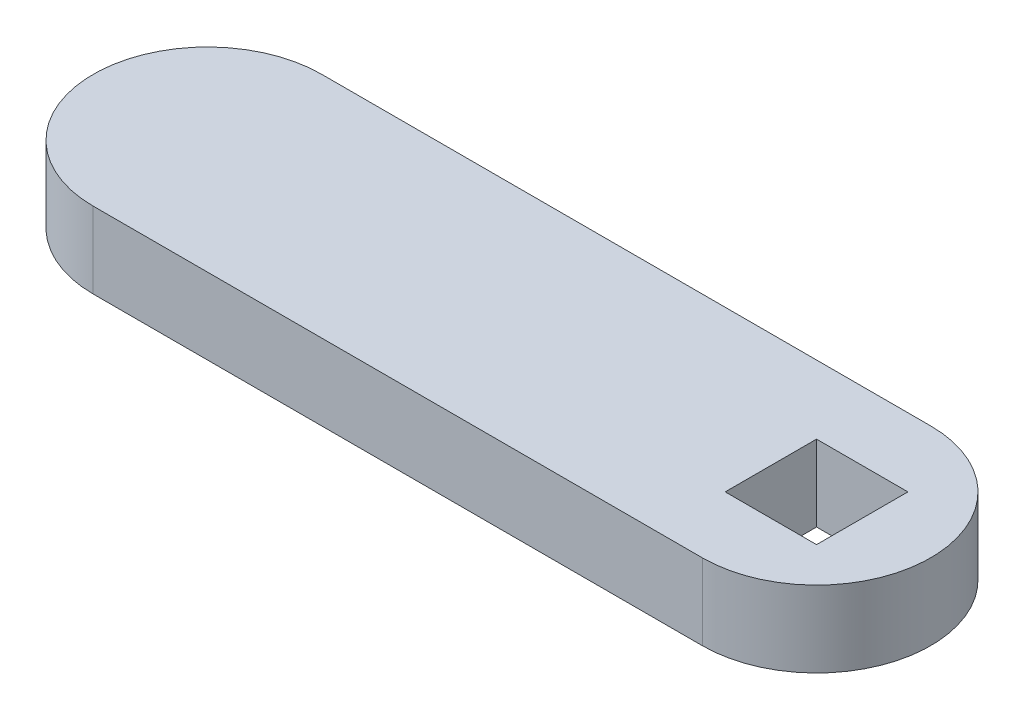
from build123d import *

# Parameters (mm, degrees)
SKETCH_1_W      = 60
SKETCH_1_H      = 60
EXTRUDE_1_DEPTH = 50


with BuildPart() as part:
    # 草图1 → 凸台-拉伸1 (new body)
    with BuildSketch(Plane(origin=(0, 0, 0), x_dir=(1, 0, 0), z_dir=(0, 1, 0))):
        with BuildLine():
            Line((0, 75), (400, 75))
            ThreePointArc((400, 75), (475, 0), (400, -75))
            Line((400, -75), (0, -75))
            ThreePointArc((0, -75), (-75, 0), (0, 75))
        make_face()
        with Locations((400, 0)):
            Rectangle(SKETCH_1_W, SKETCH_1_H, mode=Mode.SUBTRACT)
    extrude(amount=EXTRUDE_1_DEPTH)


solid = part.part
